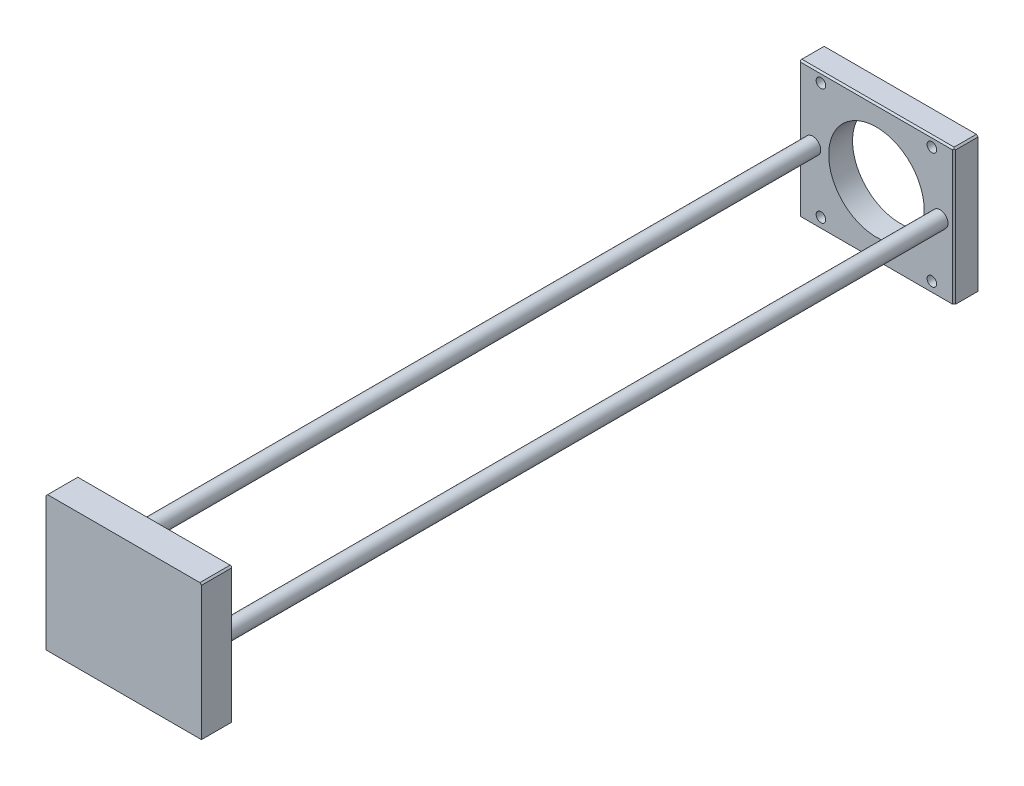
from build123d import *

# Parameters (mm, degrees)
CROQUIS1_W              = 97.7
CROQUIS1_H              = 85
CROQUIS1_R              = 3
CROQUIS1_R_2            = 30
SALIENTE_EXTRUIR1_DEPTH = 15
CROQUIS2_R              = 5
SALIENTE_EXTRUIR2_DEPTH = 453
SALIENTE_EXTRUIR3_START = 3
CROQUIS3_W              = 97.7
CROQUIS3_H              = 85
SALIENTE_EXTRUIR3_DEPTH = 20
CHAFL_N1_SIZE           = 1
CHAFL_N2_SIZE           = 1


with BuildPart() as part:
    # Croquis1 → Saliente-Extruir1 (new body)
    with BuildSketch(Plane.XY):
        Rectangle(CROQUIS1_W, CROQUIS1_H)
        with Locations((-34.85, 36.5)):
            Circle(CROQUIS1_R, mode=Mode.SUBTRACT)
        Circle(CROQUIS1_R_2, mode=Mode.SUBTRACT)
        with Locations(Location((34.85, 36.5, 0), (0, 0, 180))):
            Circle(CROQUIS1_R, mode=Mode.SUBTRACT)
        with Locations((34.85, -36.5)):
            Circle(CROQUIS1_R, mode=Mode.SUBTRACT)
        with Locations(Location((-34.85, -36.5, 0), (0, 0, 180))):
            Circle(CROQUIS1_R, mode=Mode.SUBTRACT)
    extrude(amount=SALIENTE_EXTRUIR1_DEPTH)

    # Croquis2 → Saliente-Extruir2 (add)
    with BuildSketch(Plane.XY.offset(15)):
        with Locations(Location((-40, 0, 0), (0, 0, 180))):
            Circle(CROQUIS2_R)
        with Locations(Location((40, 0, 0), (0, 0, 180))):
            Circle(CROQUIS2_R)
    extrude(amount=SALIENTE_EXTRUIR2_DEPTH)

    # Croquis3 → Saliente-Extruir3 (add)
    with BuildSketch(Plane.XY.offset(465).offset(SALIENTE_EXTRUIR3_START)):
        Rectangle(CROQUIS3_W, CROQUIS3_H)
    extrude(amount=SALIENTE_EXTRUIR3_DEPTH)

    # Chaflán1
    chafl_n1_edges = [part.edges().sort_by_distance(p)[0] for p in [
        (48.85, 0, 15),
        (0, 42.5, 15),
        (-48.85, 0, 468),
        (0, 42.5, 468),
        (48.85, 0, 468),
        (-48.85, 0, 15),
    ]]
    chamfer(chafl_n1_edges, length=CHAFL_N1_SIZE)

    # Chaflán2
    chafl_n2_edges = [part.edges().sort_by_distance(p)[0] for p in [
        (48.85, 42.5, 478.5),
        (-48.85, 42.5, 478.5),
        (-48.85, 42.5, 7),
        (48.85, 42.5, 7),
    ]]
    chamfer(chafl_n2_edges, length=CHAFL_N2_SIZE)


solid = part.part
